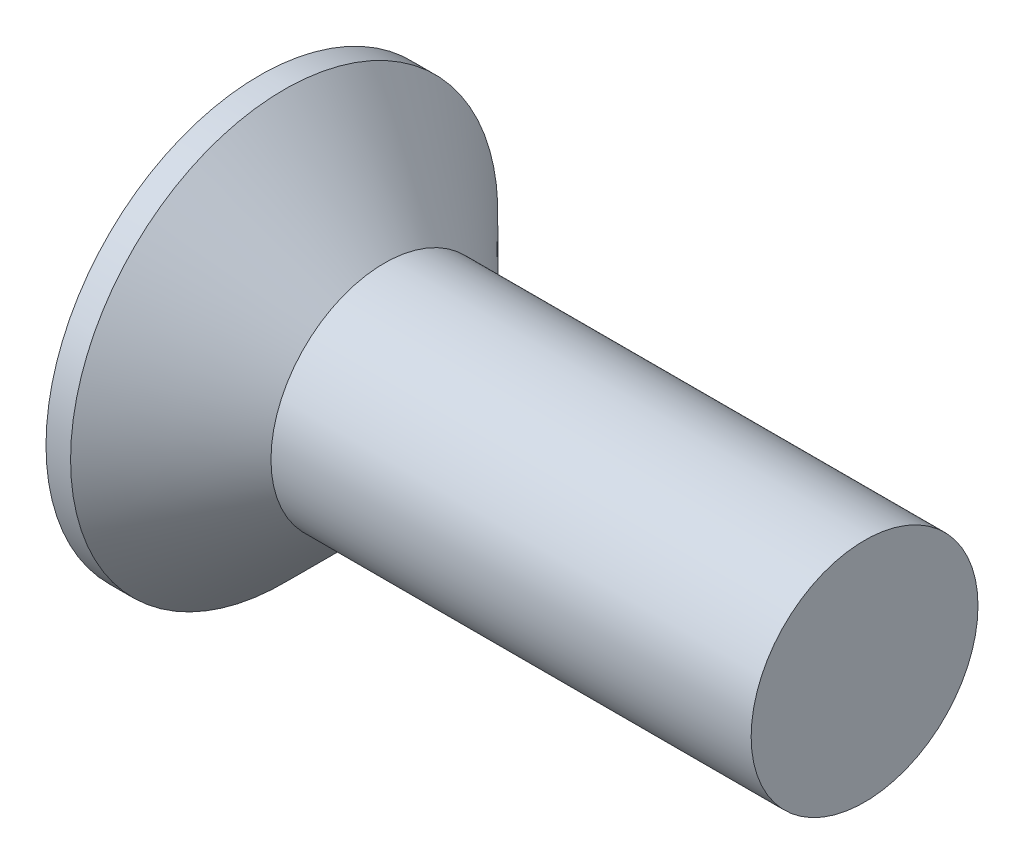
from build123d import *


with BuildPart() as part:
    # Esquisse1 → Révolution1 (revolve)
    with BuildSketch(Plane.XY, mode=Mode.PRIVATE) as r_volution1_sk:
        Polygon((0, 0), (16, 0), (16, 3), (3.3, 3), (0.65, 5.65), (0, 5.65), align=None)
    revolve(r_volution1_sk.sketch.rotate(Axis((0, 0, 0), (1, 0, 0)), 90), axis=Axis((0, 0, 0), (1, 0, 0)))


solid = part.part
